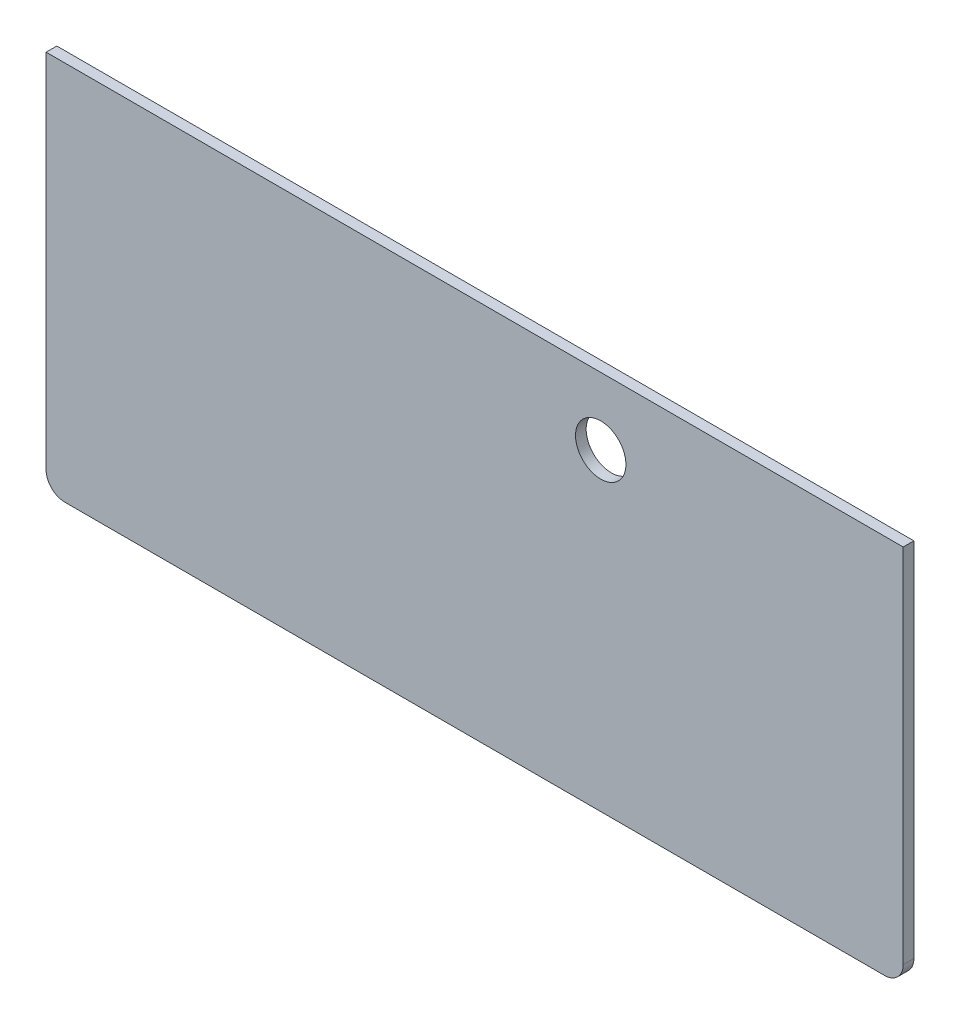
from build123d import *

# Parameters (mm, degrees)
SKETCH1_W           = 255
SKETCH1_H           = 113.175
SKETCH1_R           = 7.5
BOSS_EXTRUDE1_DEPTH = 3.175
FILLET1_R           = 5.55625


with BuildPart() as part:
    # Sketch1 → Boss-Extrude1 (new body)
    with BuildSketch(Plane.XY):
        with Locations((-24.265375854, -29.400711845)):
            Rectangle(SKETCH1_W, SKETCH1_H)
        with Locations((13.234624146, 7.186788155)):
            Circle(SKETCH1_R, mode=Mode.SUBTRACT)
    extrude(amount=BOSS_EXTRUDE1_DEPTH)

    # Fillet1
    fillet1_edges = [part.edges().sort_by_distance(p)[0] for p in [
        (103.234624146, -85.988211845, 1.5875),
        (-151.765375854, -85.988211845, 1.5875),
    ]]
    fillet(fillet1_edges, radius=FILLET1_R)


solid = part.part
